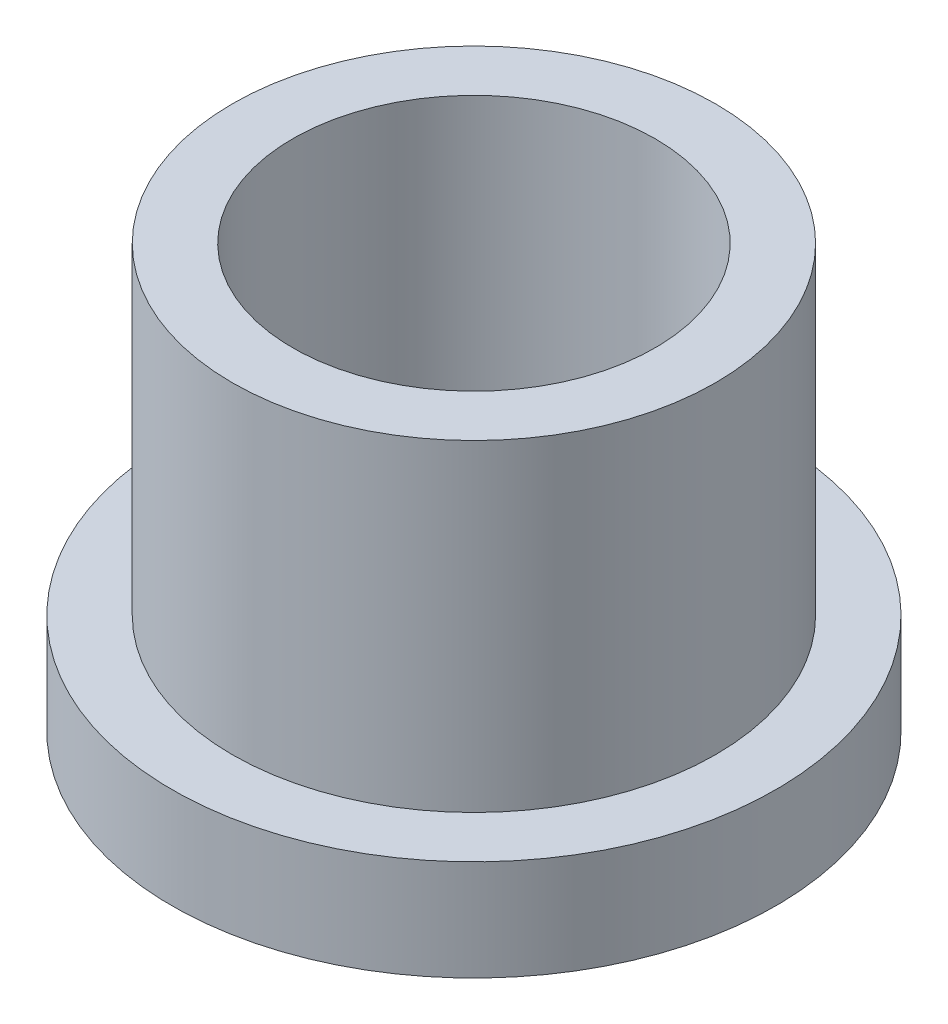
from build123d import *


with BuildPart() as part:
    # Sketch1 → Revolve1 (revolve)
    with BuildSketch(Plane.XY, mode=Mode.PRIVATE) as revolve1_sk:
        Polygon((9, 0), (9, 21), (12, 21), (12, 5), (15, 5), (15, 0), align=None)
    revolve(revolve1_sk.sketch.rotate(Axis((0, 0, 0), (0, 1, 0)), 90), axis=Axis((0, 0, 0), (0, 1, 0)))


solid = part.part
